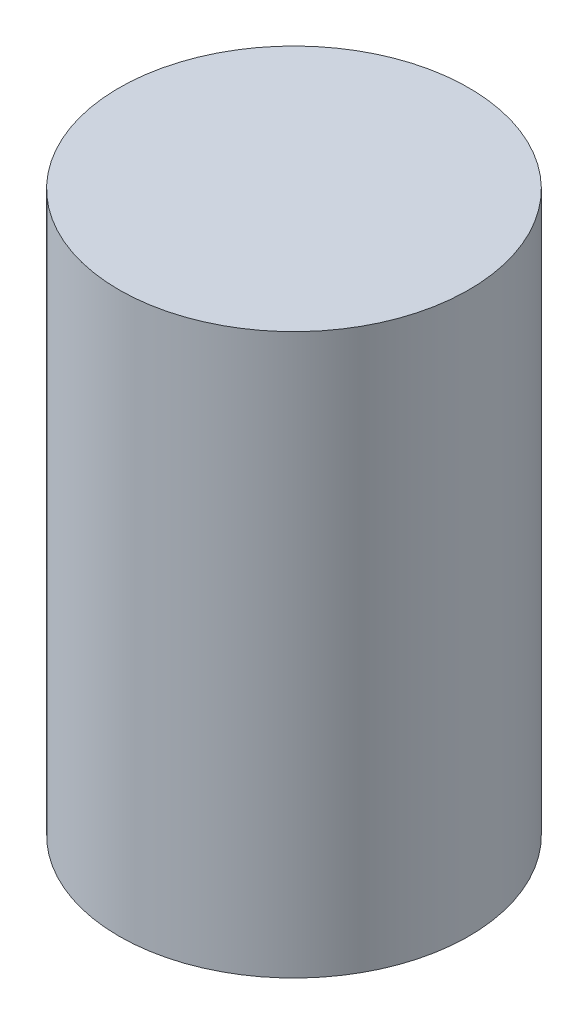
from build123d import *

# Parameters (mm, degrees)
SKETCH_1_R      = 2.5
EXTRUDE_1_DEPTH = 8


with BuildPart() as part:
    # 草图1 → 凸台-拉伸1 (new body)
    with BuildSketch(Plane(origin=(0, 0, 0), x_dir=(1, 0, 0), z_dir=(0, 1, 0))):
        with Locations(Location((0, 0, 0), (0, 0, 270))):
            Circle(SKETCH_1_R)
    extrude(amount=EXTRUDE_1_DEPTH)


solid = part.part
